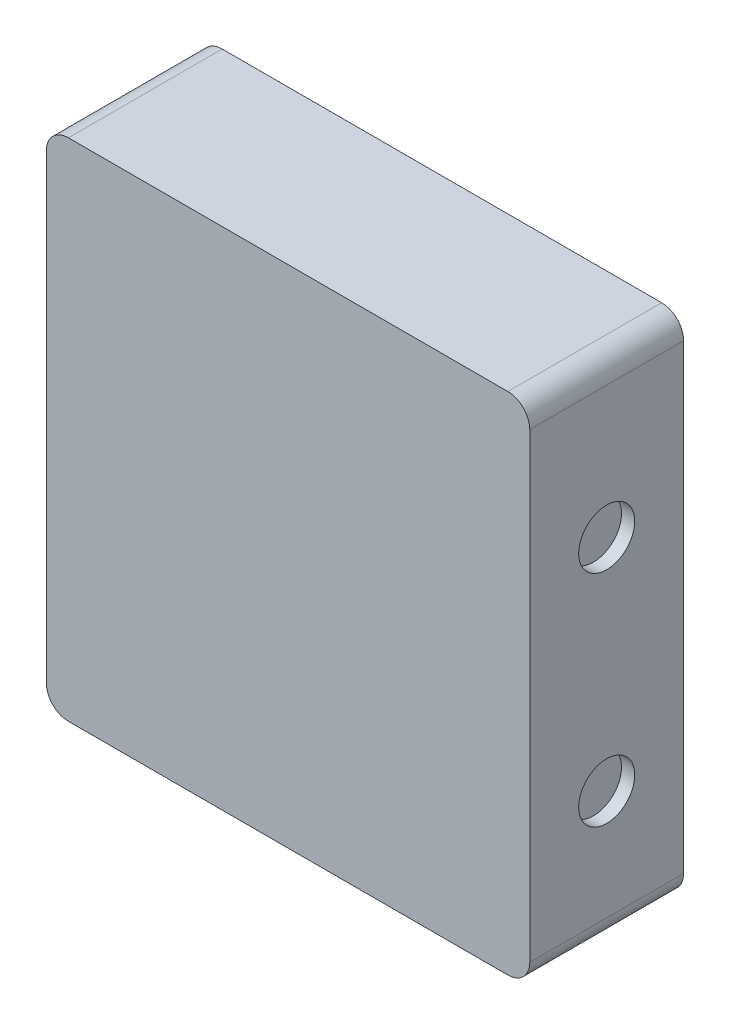
from build123d import *

# Parameters (mm, degrees)
BOSS_EXTRUDE4_DEPTH = 3
BOSS_EXTRUDE5_DEPTH = 14
BOSS_EXTRUDE6_START = 11
BOSS_EXTRUDE6_DEPTH = 3
SKETCH2_W           = 10
SKETCH2_H           = 3
CUT_EXTRUDE1_DEPTH  = 3
CUT_EXTRUDE2_START  = 22
SKETCH3_R           = 2.55
CUT_EXTRUDE2_DEPTH  = 1.2
CUT_EXTRUDE3_START  = -20.8
SKETCH3_3_R         = 2.55
CUT_EXTRUDE3_DEPTH  = 1.2
FILLET1_R           = 0.7


with BuildPart() as part:
    # Sketch1 → Boss-Extrude4 (new body)
    with BuildSketch(Plane.XY.offset(31)):
        with BuildLine():
            ThreePointArc((-22, -20), (-21.414213562, -21.414213562), (-20, -22))
            Line((-20, -22), (20, -22))
            ThreePointArc((20, -22), (21.414213562, -21.414213562), (22, -20))
            Line((22, -20), (22, 22))
            ThreePointArc((22, 22), (21.414213562, 23.414213562), (20, 24))
            Line((20, 24), (-20, 24))
            ThreePointArc((-20, 24), (-21.414213562, 23.414213562), (-22, 22))
            Line((-22, 22), (-22, -20))
        make_face()
    extrude(amount=BOSS_EXTRUDE4_DEPTH)

    # Sketch1<3> → Boss-Extrude5 (add)
    with BuildSketch(Plane.XY.offset(31)):
        with BuildLine():
            Line((-22, -10.75), (-22, -20))
            ThreePointArc((-22, -20), (-21.414213562, -21.414213562), (-20, -22))
            Line((-20, -22), (-19, -22))
            Line((-19, -22), (-19, -18))
            Line((-19, -18), (-19, -10.75))
            Line((-19, -10.75), (-19, 10.75))
            Line((-19, 10.75), (-19, 20))
            ThreePointArc((-19, 20), (-18.707106781, 20.707106781), (-18, 21))
            Line((-18, 21), (-3.938916155, 21))
            Line((-3.938916155, 21), (3.938916155, 21))
            Line((3.938916155, 21), (18, 21))
            ThreePointArc((18, 21), (18.707106781, 20.707106781), (19, 20))
            Line((19, 20), (19, 10.75))
            Line((19, 10.75), (19, -10.75))
            Line((19, -10.75), (19, -18))
            Line((19, -18), (19, -22))
            Line((19, -22), (20, -22))
            ThreePointArc((20, -22), (21.414213562, -21.414213562), (22, -20))
            Line((22, -20), (22, -10.75))
            Line((22, -10.75), (22, 10.75))
            Line((22, 10.75), (22, 22))
            ThreePointArc((22, 22), (21.414213562, 23.414213562), (20, 24))
            Line((20, 24), (3.938916155, 24))
            Line((3.938916155, 24), (-3.938916155, 24))
            Line((-3.938916155, 24), (-20, 24))
            ThreePointArc((-20, 24), (-21.414213562, 23.414213562), (-22, 22))
            Line((-22, 22), (-22, 10.75))
            Line((-22, 10.75), (-22, -10.75))
        make_face()
    extrude(amount=BOSS_EXTRUDE5_DEPTH)

    # Sketch1<4> → Boss-Extrude6 (add)
    # profile 1 of 3: a face of its own
    with BuildSketch(Plane.XY.offset(31).offset(BOSS_EXTRUDE6_START)):
        with BuildLine():
            Line((-22, -20), (-22, -10.75))
            Line((-22, -10.75), (-22, 10.75))
            Line((-22, 10.75), (-22, 22))
            ThreePointArc((-22, 22), (-21.414213562, 23.414213562), (-20, 24))
            Line((-20, 24), (-3.938916155, 24))
            Line((-3.938916155, 24), (3.938916155, 24))
            Line((3.938916155, 24), (20, 24))
            ThreePointArc((20, 24), (21.414213562, 23.414213562), (22, 22))
            Line((22, 22), (22, 10.75))
            Line((22, 10.75), (22, -10.75))
            Line((22, -10.75), (22, -20))
            ThreePointArc((22, -20), (21.414213562, -21.414213562), (20, -22))
            Line((20, -22), (10.75, -22))
            Line((10.75, -22), (-10.75, -22))
            Line((-10.75, -22), (-20, -22))
            ThreePointArc((-20, -22), (-21.414213562, -21.414213562), (-22, -20))
        make_face()
        with BuildLine():
            ThreePointArc((-18, 21), (-18.707106781, 20.707106781), (-19, 20))
            Line((-19, 20), (-19, 10.75))
            Line((-19, 10.75), (-19, -10.75))
            Line((-19, -10.75), (-19, -18))
            ThreePointArc((-19, -18), (-18.707106781, -18.707106781), (-18, -19))
            Line((-18, -19), (-10.75, -19))
            Line((-10.75, -19), (10.75, -19))
            Line((10.75, -19), (18, -19))
            ThreePointArc((18, -19), (18.707106781, -18.707106781), (19, -18))
            Line((19, -18), (19, -10.75))
            Line((19, -10.75), (19, 10.75))
            Line((19, 10.75), (19, 20))
            ThreePointArc((19, 20), (18.707106781, 20.707106781), (18, 21))
            Line((18, 21), (3.938916155, 21))
            Line((3.938916155, 21), (-3.938916155, 21))
            Line((-3.938916155, 21), (-18, 21))
        make_face(mode=Mode.SUBTRACT)
    # profile 2 of 3: a face of its own
    with BuildSketch(Plane.XY.offset(31).offset(BOSS_EXTRUDE6_START)):
        with BuildLine():
            Line((-18, 21), (-3.938916155, 21))
            Line((-3.938916155, 21), (3.938916155, 21))
            Line((3.938916155, 21), (18, 21))
            ThreePointArc((18, 21), (18.707106781, 20.707106781), (19, 20))
            Line((19, 20), (19, 10.75))
            Line((19, 10.75), (19, -10.75))
            Line((19, -10.75), (19, -18))
            ThreePointArc((19, -18), (18.707106781, -18.707106781), (18, -19))
            Line((18, -19), (10.75, -19))
            Line((10.75, -19), (-10.75, -19))
            Line((-10.75, -19), (-18, -19))
            ThreePointArc((-18, -19), (-18.707106781, -18.707106781), (-19, -18))
            Line((-19, -18), (-19, -10.75))
            Line((-19, -10.75), (-19, 10.75))
            Line((-19, 10.75), (-19, 20))
            ThreePointArc((-19, 20), (-18.707106781, 20.707106781), (-18, 21))
        make_face()
    # profile 3 of 3: a face of its own
    with BuildSketch(Plane.XY.offset(31).offset(BOSS_EXTRUDE6_START)):
        with BuildLine():
            Line((-19, -18), (-19, -22))
            Line((-19, -22), (-10.75, -22))
            Line((-10.75, -22), (10.75, -22))
            Line((10.75, -22), (19, -22))
            Line((19, -22), (19, -18))
            ThreePointArc((19, -18), (18.707106781, -18.707106781), (18, -19))
            Line((18, -19), (10.75, -19))
            Line((10.75, -19), (-10.75, -19))
            Line((-10.75, -19), (-18, -19))
            ThreePointArc((-18, -19), (-18.707106781, -18.707106781), (-19, -18))
        make_face()
    extrude(amount=BOSS_EXTRUDE6_DEPTH)

    # Sketch2 → Cut-Extrude1 (cut)
    with BuildSketch(Plane.XZ.offset(22)):
        with Locations((0, 32.5)):
            Rectangle(SKETCH2_W, SKETCH2_H)
        with Locations((0, 35.5)):
            Rectangle(SKETCH2_W, SKETCH2_H)
    extrude(amount=-CUT_EXTRUDE1_DEPTH, mode=Mode.SUBTRACT)

    # Sketch3 → Cut-Extrude2 (cut)
    with BuildSketch(Plane(origin=(0, 0, 0), x_dir=(0, 0, -1), z_dir=(1, 0, 0)).offset(CUT_EXTRUDE2_START)):
        with Locations(Location((-38, 10, 0), (0, 0, 90))):
            Circle(SKETCH3_R)
        with Locations(Location((-38, -10, 0), (0, 0, 90))):
            Circle(SKETCH3_R)
    extrude(amount=-CUT_EXTRUDE2_DEPTH, mode=Mode.SUBTRACT)

    # Sketch3<3> → Cut-Extrude3 (cut)
    with BuildSketch(Plane(origin=(0, 0, 0), x_dir=(0, 0, -1), z_dir=(1, 0, 0)).offset(CUT_EXTRUDE3_START)):
        with Locations(Location((-38, -10, 0), (0, 0, 90))):
            Circle(SKETCH3_3_R)
        with Locations(Location((-38, 10, 0), (0, 0, 90))):
            Circle(SKETCH3_3_R)
    extrude(amount=-CUT_EXTRUDE3_DEPTH, mode=Mode.SUBTRACT)

    # Fillet1
    fillet1_edges = [part.edges().sort_by_distance(p)[0] for p in [
        (-19, -22, 38),
        (0, -22, 42),
        (0, 21, 42),
        (19, -1, 42),
        (-19, -1, 42),
        (18.707106781, 20.707106781, 42),
        (-12, -22, 34),
        (-5, -20.5, 34),
        (5, -20.5, 34),
        (0, -19, 31),
        (5, -20.5, 31),
        (-5, -19, 32.5),
        (-5, -20.5, 31),
        (5, -19, 32.5),
        (0, -19, 34),
        (12, -22, 34),
        (19, -1, 34),
        (0, 21, 34),
        (-19, -1, 34),
        (18.707106781, 20.707106781, 34),
        (-18.707106781, 20.707106781, 34),
        (-18.707106781, 20.707106781, 42),
        (19, -22, 38),
    ]]
    fillet(fillet1_edges, radius=FILLET1_R)


solid = part.part
